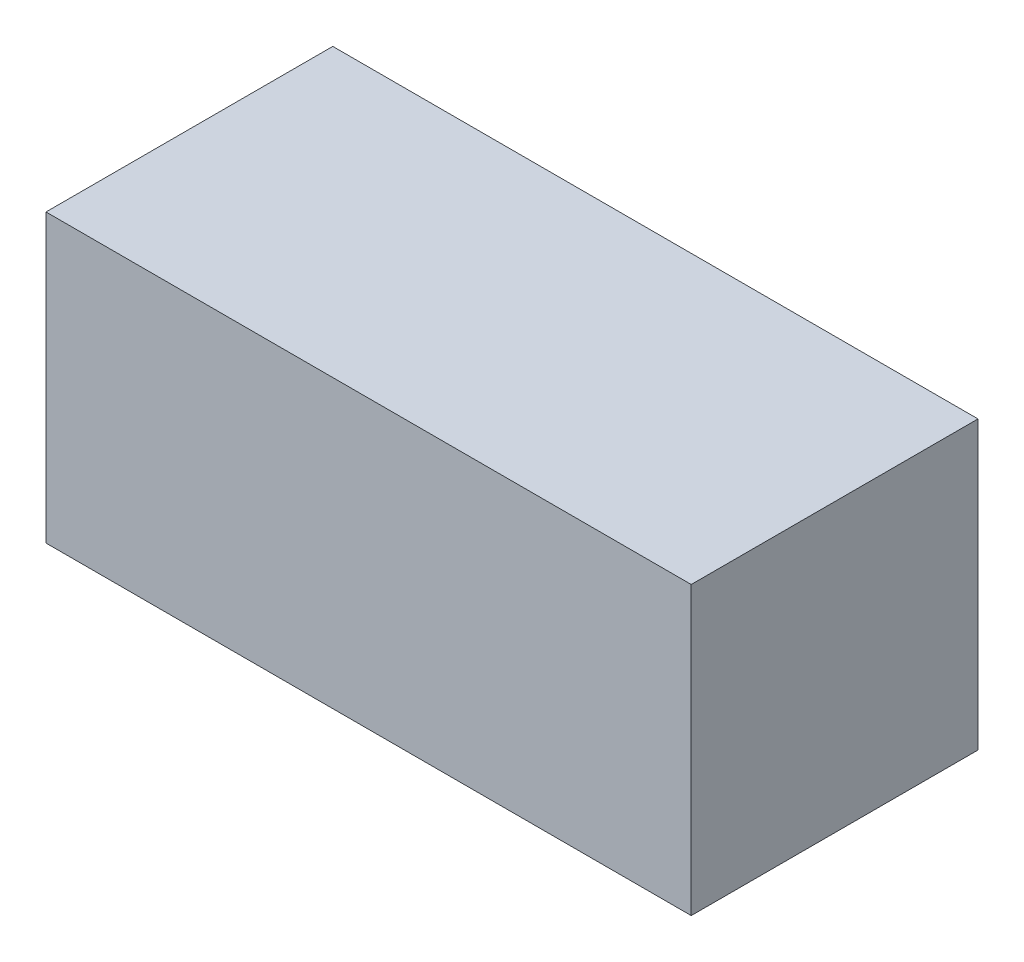
from build123d import *

# Parameters (mm, degrees)
SKETCH2_W           = 457.2
SKETCH2_H           = 203.2
BOSS_EXTRUDE1_DEPTH = 203.2


with BuildPart() as part:
    # Sketch2 → Boss-Extrude1 (new body)
    with BuildSketch(Plane(origin=(0, 0, 0), x_dir=(1, 0, 0), z_dir=(0, 1, 0))):
        with Locations((-228.6, 101.6)):
            Rectangle(SKETCH2_W, SKETCH2_H)
    extrude(amount=BOSS_EXTRUDE1_DEPTH)


solid = part.part
